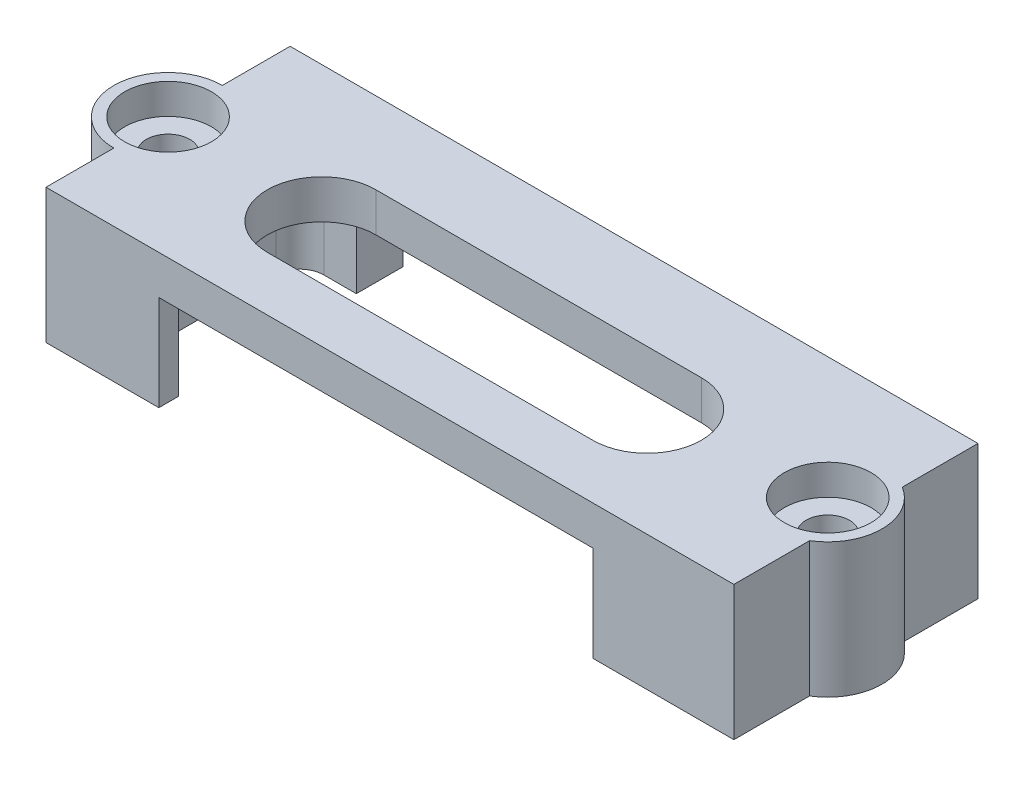
from build123d import *

# Parameters (mm, degrees)
EXTRUDE_1_DEPTH     = 6.2
SKETCH_2_W          = 20
SKETCH_2_H          = 11.25
CUT_EXTRUDE_1_DEPTH = 4.4
CUT_EXTRUDE_2_DEPTH = 4.4
SKETCH_4_R          = 1
CUT_EXTRUDE_3_DEPTH = 21.169361046
SKETCH_5_R          = 2
CUT_EXTRUDE_4_DEPTH = 1.4
CUT_EXTRUDE_5_DEPTH = 4.4
CUT_EXTRUDE_6_DEPTH = 4.2


with BuildPart() as part:
    # 草图1 → 凸台-拉伸1 (new body)
    with BuildSketch(Plane(origin=(0, 0, 0), x_dir=(1, 0, 0), z_dir=(0, 1, 0))):
        with BuildLine():
            Line((-15.85, -5.625), (15.85, -5.625))
            Line((15.85, -5.625), (15.85, -2.13541565))
            ThreePointArc((15.85, -2.13541565), (17.05, 0), (15.85, 2.13541565))
            Line((15.85, 2.13541565), (15.85, 5.625))
            Line((15.85, 5.625), (-15.85, 5.625))
            Line((-15.85, 5.625), (-15.85, 2.5))
            ThreePointArc((-15.85, 2.5), (-18.35, 0), (-15.85, -2.5))
            Line((-15.85, -2.5), (-15.85, -5.625))
        make_face()
    extrude(amount=EXTRUDE_1_DEPTH)

    # 草图2 → 切除-拉伸1 (cut)
    with BuildSketch(Plane.XZ):
        with Locations((-0.65, 0)):
            Rectangle(SKETCH_2_W, SKETCH_2_H)
    extrude(amount=-CUT_EXTRUDE_1_DEPTH, mode=Mode.SUBTRACT)

    # 草图3 → 切除-拉伸2 (cut)
    with BuildSketch(Plane.XZ):
        with BuildLine():
            Line((-12.15, 4.625), (10.85, 4.625))
            ThreePointArc((10.85, 4.625), (11.557106781, 4.332106781), (11.85, 3.625))
            Line((11.85, 3.625), (11.85, -2.375))
            ThreePointArc((11.85, -2.375), (11.557106781, -3.082106781), (10.85, -3.375))
            Line((10.85, -3.375), (-12.15, -3.375))
            ThreePointArc((-12.15, -3.375), (-12.857106781, -3.082106781), (-13.15, -2.375))
            Line((-13.15, -2.375), (-13.15, 3.625))
            ThreePointArc((-13.15, 3.625), (-12.857106781, 4.332106781), (-12.15, 4.625))
        make_face()
    extrude(amount=-CUT_EXTRUDE_2_DEPTH, mode=Mode.SUBTRACT)

    # 草图4 → 切除-拉伸3 (cut, through all)
    with BuildSketch(Plane(origin=(0, 6.2, 0), x_dir=(1, 0, 0), z_dir=(0, 1, 0))):
        with Locations((-15.85, 0)):
            Circle(SKETCH_4_R)
        with Locations((14.55, 0)):
            Circle(SKETCH_4_R)
    extrude(amount=-CUT_EXTRUDE_3_DEPTH, mode=Mode.SUBTRACT)

    # 草图5 → 切除-拉伸4 (cut)
    with BuildSketch(Plane(origin=(0, 6.2, 0), x_dir=(1, 0, 0), z_dir=(0, 1, 0))):
        with Locations((-15.85, 0)):
            Circle(SKETCH_5_R)
        with Locations((14.55, 0)):
            Circle(SKETCH_5_R)
    extrude(amount=-CUT_EXTRUDE_4_DEPTH, mode=Mode.SUBTRACT)

    # 草图6 → 切除-拉伸5 (cut)
    with BuildSketch(Plane.XZ):
        with BuildLine():
            Line((11.95, 3.625), (11.95, -2.375))
            ThreePointArc((11.95, -2.375), (11.627817459, -3.152817459), (10.85, -3.475))
            Line((10.85, -3.475), (-12.15, -3.475))
            ThreePointArc((-12.15, -3.475), (-12.927817459, -3.152817459), (-13.25, -2.375))
            Line((-13.25, -2.375), (-13.25, 3.625))
            ThreePointArc((-13.25, 3.625), (-12.927817459, 4.402817459), (-12.15, 4.725))
            Line((-12.15, 4.725), (10.85, 4.725))
            ThreePointArc((10.85, 4.725), (11.627817459, 4.402817459), (11.95, 3.625))
        make_face()
    extrude(amount=-CUT_EXTRUDE_5_DEPTH, mode=Mode.SUBTRACT)

    # 草图7 → 切除-拉伸6 (cut)
    with BuildSketch(Plane.XZ.offset(-4.4)):
        with BuildLine():
            Line((-8.15, 3.125), (6.85, 3.125))
            ThreePointArc((6.85, 3.125), (9.35, 0.625), (6.85, -1.875))
            Line((6.85, -1.875), (-8.15, -1.875))
            ThreePointArc((-8.15, -1.875), (-10.65, 0.625), (-8.15, 3.125))
        make_face()
    extrude(amount=-CUT_EXTRUDE_6_DEPTH, mode=Mode.SUBTRACT)


solid = part.part
